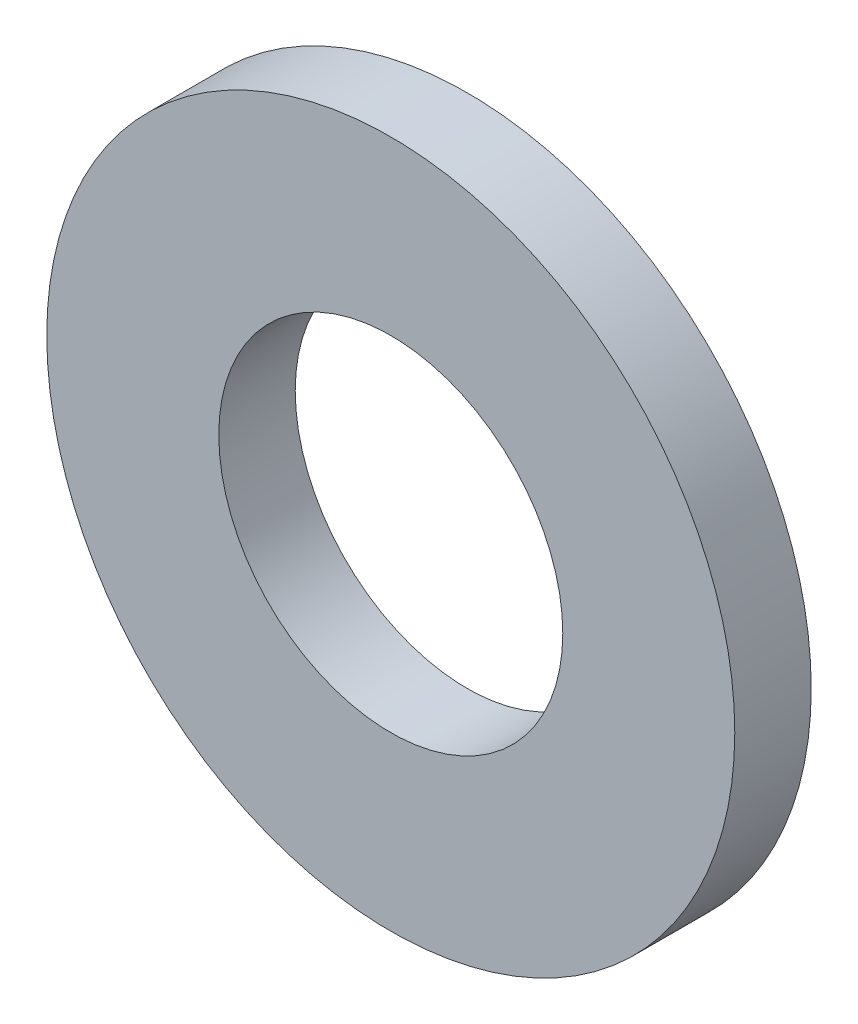
from build123d import *

# Parameters (mm, degrees)
SKETCH_1_R      = 4.5
SKETCH_1_R_2    = 2.25
EXTRUDE_1_DEPTH = 1


with BuildPart() as part:
    # 草圖1 → 填料-伸長1 (new body)
    with BuildSketch(Plane.XY):
        Circle(SKETCH_1_R)
        Circle(SKETCH_1_R_2, mode=Mode.SUBTRACT)
    extrude(amount=EXTRUDE_1_DEPTH)


solid = part.part
